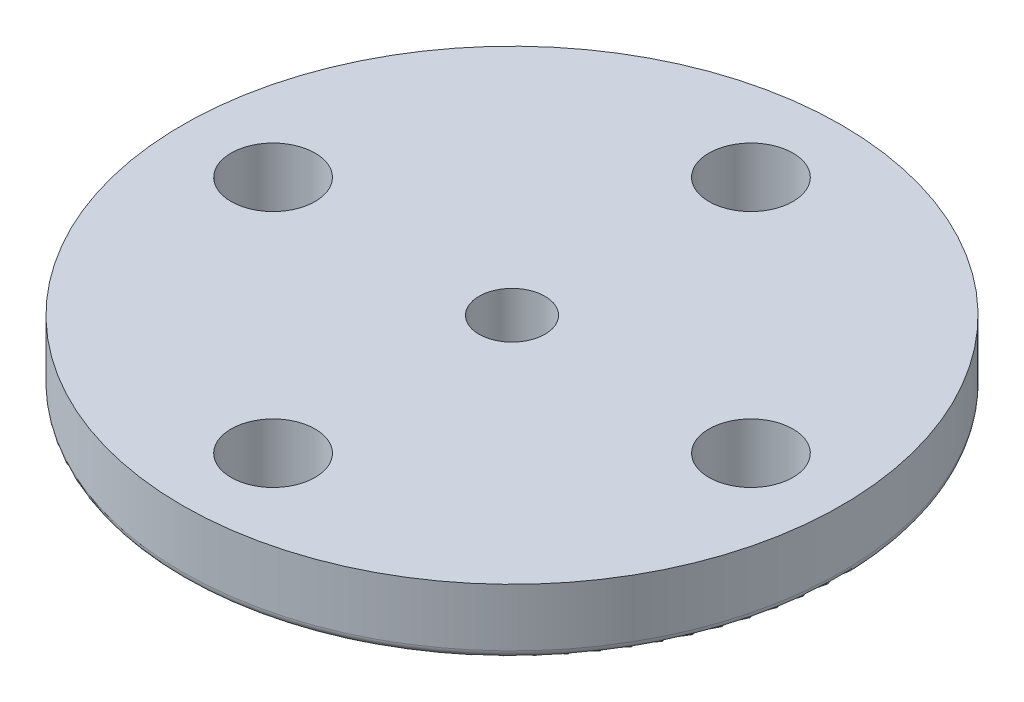
from build123d import *

# Parameters (mm, degrees)
SKETCH1_R           = 10
BOSS_EXTRUDE1_DEPTH = 2
SKETCH2_R           = 4.5
BOSS_EXTRUDE2_DEPTH = 2.5
SKETCH3_R           = 1.275
CUT_EXTRUDE1_DEPTH  = 15.361406616
FILLET1_R           = 0.25
SKETCH6_R           = 1
CUT_EXTRUDE2_DEPTH  = 15.840822214
SKETCH7_R           = 2.9
CUT_EXTRUDE3_DEPTH  = 2.5


with BuildPart() as part:
    # Sketch1 → Boss-Extrude1 (new body)
    with BuildSketch(Plane(origin=(0, 0, 0), x_dir=(1, 0, 0), z_dir=(0, 1, 0))):
        with Locations(Location((0, 0, 0), (0, 0, 270))):
            Circle(SKETCH1_R)
    extrude(amount=BOSS_EXTRUDE1_DEPTH)

    # Sketch2 → Boss-Extrude2 (add)
    with BuildSketch(Plane(origin=(0, 0, 0), x_dir=(1, 0, 0), z_dir=(0, 1, 0))):
        with Locations(Location((0, 0, 0), (0, 0, 270))):
            Circle(SKETCH2_R)
    extrude(amount=-BOSS_EXTRUDE2_DEPTH)

    # Sketch3 → Cut-Extrude1 (cut, through all)
    with BuildSketch(Plane(origin=(0, 0, 0), x_dir=(1, 0, 0), z_dir=(0, 1, 0))):
        with Locations(Location((0, 7.25, 0), (0, 0, 270))):
            Circle(SKETCH3_R)
        with Locations(Location((-7.25, 0, 0), (0, 0, 270))):
            Circle(SKETCH3_R)
        with Locations(Location((0, -7.25, 0), (0, 0, 90))):
            Circle(SKETCH3_R)
        with Locations(Location((7.25, 0, 0), (0, 0, 90))):
            Circle(SKETCH3_R)
    extrude(amount=CUT_EXTRUDE1_DEPTH, mode=Mode.SUBTRACT)

    # Fillet1
    fillet1_edges = [part.edges().sort_by_distance(p)[0] for p in [
        (0, 0, -10),
    ]]
    fillet(fillet1_edges, radius=FILLET1_R)

    # Sketch6 → Cut-Extrude2 (cut, through all)
    with BuildSketch(Plane(origin=(0, 2, 0), x_dir=(1, 0, 0), z_dir=(0, 1, 0))):
        with Locations(Location((0, 0, 0), (0, 0, 270))):
            Circle(SKETCH6_R)
    extrude(amount=-CUT_EXTRUDE2_DEPTH, mode=Mode.SUBTRACT)

    # Sketch7 → Cut-Extrude3 (cut)
    with BuildSketch(Plane.XZ.offset(2.5)):
        with Locations(Location((0, 0, 0), (0, 0, 270))):
            Circle(SKETCH7_R)
    extrude(amount=-CUT_EXTRUDE3_DEPTH, mode=Mode.SUBTRACT)


solid = part.part
